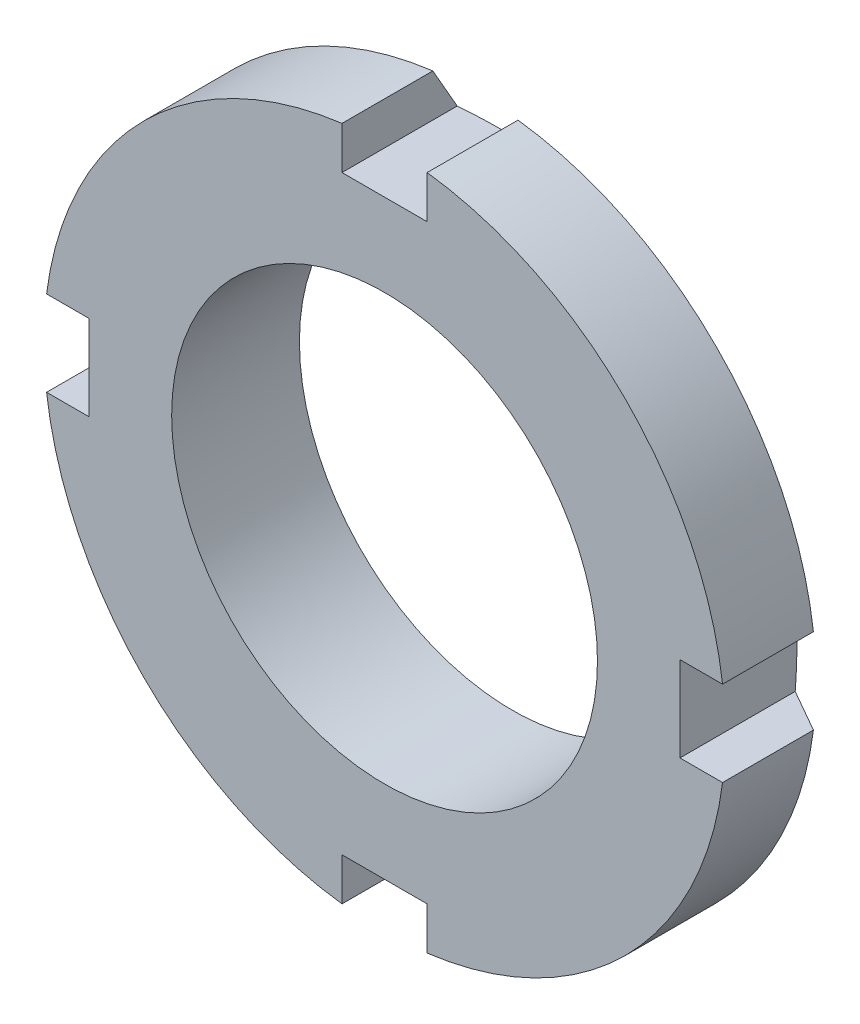
from build123d import *

# Parameters (mm, degrees)
ESQUISSE2_OUTSIDE_W     = 43.13
ESQUISSE2_OUTSIDE_H     = 43.13
ENL_V_MAT_EXTRU_2_DEPTH = 24.409399821


with BuildPart() as part:
    # Esquisse1 → Base-Révolution (revolve)
    with BuildSketch(Plane(origin=(0, 0, 0), x_dir=(0, 0, -1), z_dir=(1, 0, 0)), mode=Mode.PRIVATE) as base_r_volution_sk:
        Polygon((0, 10), (0, 13), (-1.732050808, 16), (-6, 16), (-6, 10), align=None)
    revolve(base_r_volution_sk.sketch.rotate(Axis((0, 0, 0), (0, 0, 1)), 90), axis=Axis((0, 0, 0), (0, 0, 1)))

    # Esquisse2 outside → Enlèv. mat.-Extru.2 (cut, through all)
    with BuildSketch(Plane.XY):
        Rectangle(ESQUISSE2_OUTSIDE_W, ESQUISSE2_OUTSIDE_H)
        with BuildLine():
            Line((-2, 13.874507866), (2, 13.874507866))
            Line((2, 13.874507866), (2, 15.874507866))
            ThreePointArc((2, 15.874507866), (11.313708499, 11.313708499), (15.874507866, 2))
            Line((15.874507866, 2), (13.874507866, 2))
            Line((13.874507866, 2), (13.874507866, -2))
            Line((13.874507866, -2), (15.874507866, -2))
            ThreePointArc((15.874507866, -2), (11.313708499, -11.313708499), (2, -15.874507866))
            Line((2, -15.874507866), (2, -13.874507866))
            Line((2, -13.874507866), (-2, -13.874507866))
            Line((-2, -13.874507866), (-2, -15.874507866))
            ThreePointArc((-2, -15.874507866), (-11.313708499, -11.313708499), (-15.874507866, -2))
            Line((-15.874507866, -2), (-13.874507866, -2))
            Line((-13.874507866, -2), (-13.874507866, 2))
            Line((-13.874507866, 2), (-15.874507866, 2))
            ThreePointArc((-15.874507866, 2), (-11.313708499, 11.313708499), (-2, 15.874507866))
            Line((-2, 15.874507866), (-2, 13.874507866))
        make_face(mode=Mode.SUBTRACT)
    extrude(amount=ENL_V_MAT_EXTRU_2_DEPTH, mode=Mode.SUBTRACT)


solid = part.part
